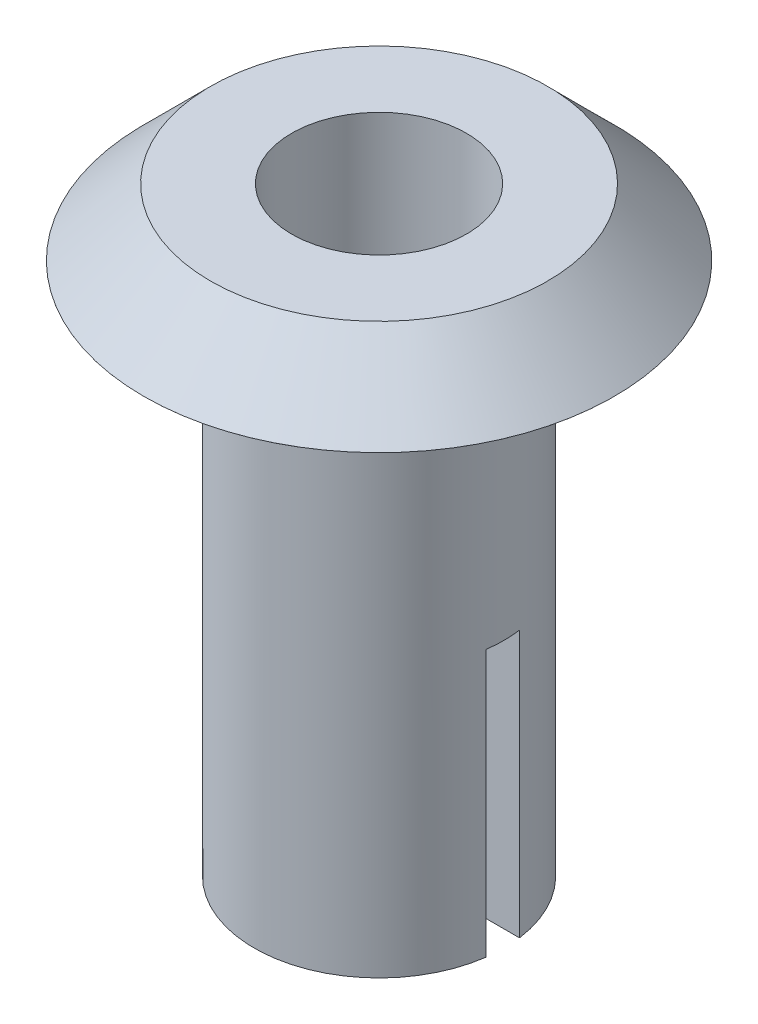
from build123d import *

# Parameters (mm, degrees)
CROQUIS1_R                   = 1.5
SALIENTE_EXTRUIR1_DEPTH      = 7.2
SALIENTE_EXTRUIR2_DEPTH      = 0.0001
SALIENTE_EXTRUIR2_DEPTH_BACK = 0.8
CROQUIS2_R                   = 2.825
CHAFL_N1_SIZE                = 0.8
CROQUIS3_R                   = 1.05
CORTAR_EXTRUIR1_DEPTH        = 5.7
REDONDEO2_R                  = 0.8
CROQUIS6_W                   = 3
CROQUIS6_H                   = 0.4
CORTAR_EXTRUIR4_DEPTH        = 3.2


with BuildPart() as part:
    # Croquis1 → Saliente-Extruir1 (new body)
    with BuildSketch(Plane(origin=(0, 0, 0), x_dir=(1, 0, 0), z_dir=(0, 1, 0))):
        with Locations(Location((0, 0, 0), (0, 0, 270))):
            Circle(CROQUIS1_R)
    extrude(amount=SALIENTE_EXTRUIR1_DEPTH)

    # Croquis2 → Saliente-Extruir2 (add, two sides: drawn at the far end of the back side and taken through both)
    with BuildSketch(Plane(origin=(0, 7.2, 0), x_dir=(1, 0, 0), z_dir=(0, 1, 0)).offset(-SALIENTE_EXTRUIR2_DEPTH_BACK)):
        with Locations(Location((0, 0, 0), (0, 0, 270))):
            Circle(CROQUIS2_R)
    extrude(amount=SALIENTE_EXTRUIR2_DEPTH + SALIENTE_EXTRUIR2_DEPTH_BACK)

    # Chaflán1
    chafl_n1_edges = [part.edges().sort_by_distance(p)[0] for p in [
        (0, 7.2001, -2.825),
    ]]
    chamfer(chafl_n1_edges, length=CHAFL_N1_SIZE)

    # Croquis3 → Cortar-Extruir1 (cut)
    with BuildSketch(Plane(origin=(0, 7.2001, 0), x_dir=(1, 0, 0), z_dir=(0, 1, 0))):
        with Locations(Location((0, 0, 0), (0, 0, 270))):
            Circle(CROQUIS3_R)
    extrude(amount=-CORTAR_EXTRUIR1_DEPTH, mode=Mode.SUBTRACT)

    # Redondeo2
    redondeo2_edges = [part.edges().sort_by_distance(p)[0] for p in [
        (0, 1.5001, -1.05),
    ]]
    fillet(redondeo2_edges, radius=REDONDEO2_R)

    # Croquis6 → Cortar-Extruir4 (cut)
    with BuildSketch(Plane(origin=(0, 0, 0), x_dir=(-1, 0, 0), z_dir=(0, -1, 0))):
        Rectangle(CROQUIS6_W, CROQUIS6_H)
    extrude(amount=-CORTAR_EXTRUIR4_DEPTH, mode=Mode.SUBTRACT)


solid = part.part
